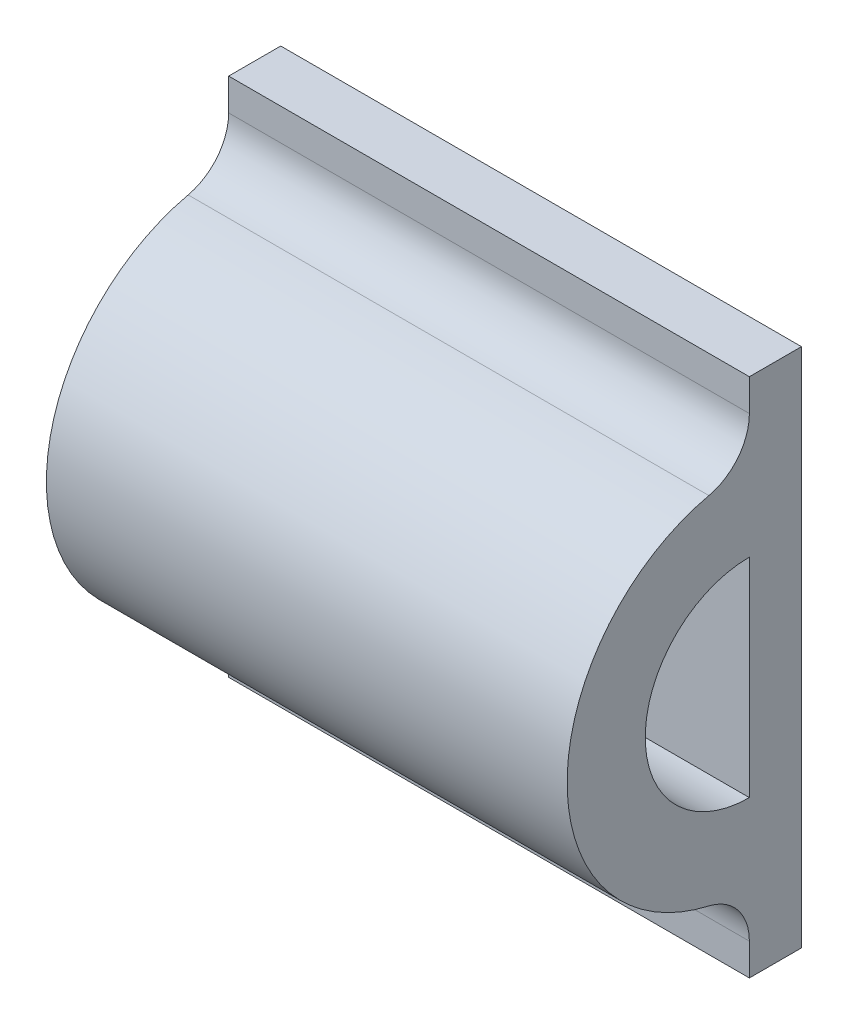
from build123d import *

# Parameters (mm, degrees)
CROQUIS1_W              = 10
CROQUIS1_H              = 10
SALIENTE_EXTRUIR1_DEPTH = 1
SALIENTE_EXTRUIR2_START = 5
SALIENTE_EXTRUIR2_DEPTH = 10
REDONDEO2_R             = 1
REDONDEO3_R             = 1


with BuildPart() as part:
    # Croquis1 → Saliente-Extruir1 (new body)
    with BuildSketch(Plane.XY):
        Rectangle(CROQUIS1_W, CROQUIS1_H)
    extrude(amount=SALIENTE_EXTRUIR1_DEPTH)

    # Croquis2 → Saliente-Extruir2 (add, through all)
    with BuildSketch(Plane(origin=(0, 0, 0), x_dir=(0, 0, -1), z_dir=(1, 0, 0)).offset(SALIENTE_EXTRUIR2_START)):
        with BuildLine():
            Line((-1, 3.5), (-1, 2))
            ThreePointArc((-1, 2), (-3, 0), (-1, -2))
            Line((-1, -2), (-1, -3.5))
            ThreePointArc((-1, -3.5), (-4.5, 0), (-1, 3.5))
        make_face()
    extrude(amount=-SALIENTE_EXTRUIR2_DEPTH)

    # Redondeo2
    redondeo2_edges = [part.edges().sort_by_distance(p)[0] for p in [
        (0, 3.5, 1),
    ]]
    fillet(redondeo2_edges, radius=REDONDEO2_R)

    # Redondeo3
    redondeo3_edges = [part.edges().sort_by_distance(p)[0] for p in [
        (0, -3.5, 1),
    ]]
    fillet(redondeo3_edges, radius=REDONDEO3_R)


solid = part.part
